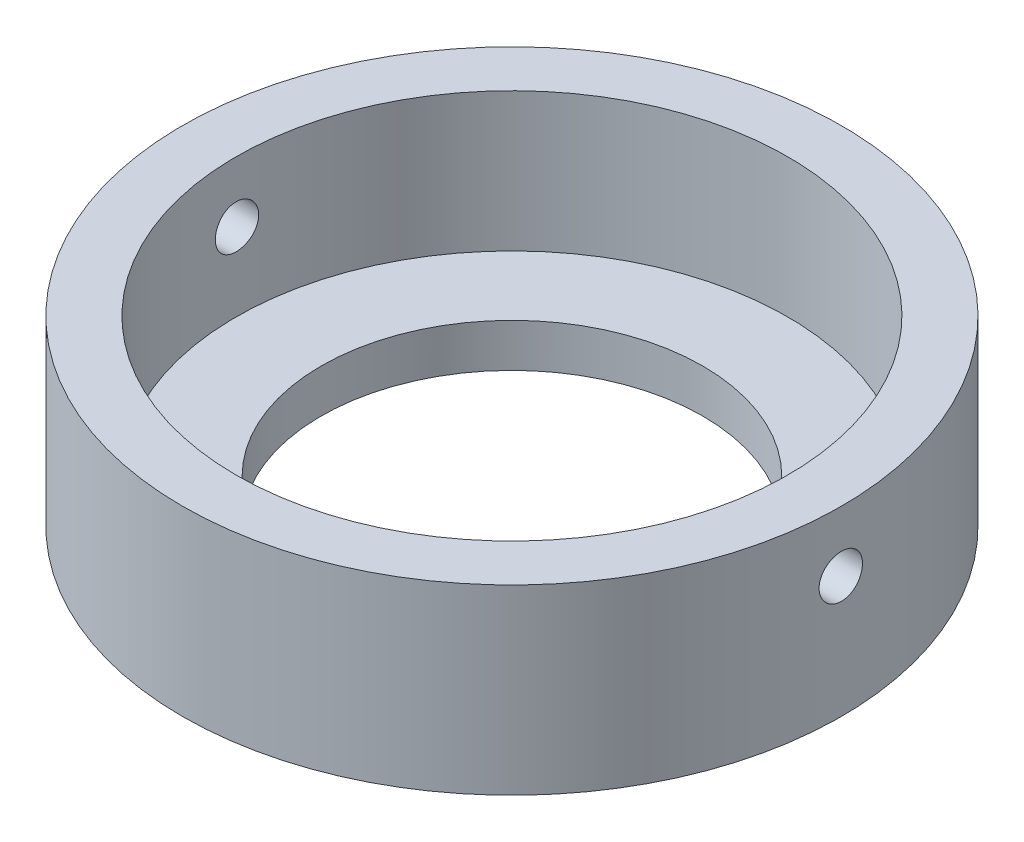
from build123d import *

# Parameters (mm, degrees)
SKETCH_1_R          = 19
EXTRUDE_1_DEPTH     = 2.5
SKETCH_2_R          = 19
SKETCH_2_R_2        = 15.9
EXTRUDE_2_DEPTH     = 8
SKETCH_3_R          = 11
CUT_EXTRUDE_1_DEPTH = 6


with BuildPart() as part:
    # 草图1 → 凸台-拉伸1 (new body)
    with BuildSketch(Plane(origin=(0, 0, 0), x_dir=(1, 0, 0), z_dir=(0, 1, 0))):
        with Locations(Location((0, 0, 0), (0, 0, 270))):
            Circle(SKETCH_1_R)
    extrude(amount=EXTRUDE_1_DEPTH)

    # 草图2 → 凸台-拉伸2 (add)
    with BuildSketch(Plane(origin=(0, 2.5, 0), x_dir=(1, 0, 0), z_dir=(0, 1, 0))):
        with Locations(Location((0, 0, 0), (0, 0, 270))):
            Circle(SKETCH_2_R)
        with Locations(Location((0, 0, 0), (0, 0, 270))):
            Circle(SKETCH_2_R_2, mode=Mode.SUBTRACT)
    extrude(amount=EXTRUDE_2_DEPTH)

    # 草图3 → 切除-拉伸1 (cut)
    with BuildSketch(Plane.XZ):
        with Locations(Location((0, 0, 0), (0, 0, 270))):
            Circle(SKETCH_3_R)
    extrude(amount=-CUT_EXTRUDE_1_DEPTH, mode=Mode.SUBTRACT)

    # 草图10 → M3 螺纹孔1 (revolve, cut)
    with BuildSketch(Plane(origin=(-19, 7, 0), x_dir=(0, 0, 1), z_dir=(0, 1, 0))):
        Polygon((0, 0), (0, 44.651075774), (1.25, 43.9), (1.25, 0.275), (1.525, 0), align=None)
    revolve(axis=Axis((-25.35, 7, 0), (1, 0, 0)), mode=Mode.SUBTRACT)


solid = part.part
